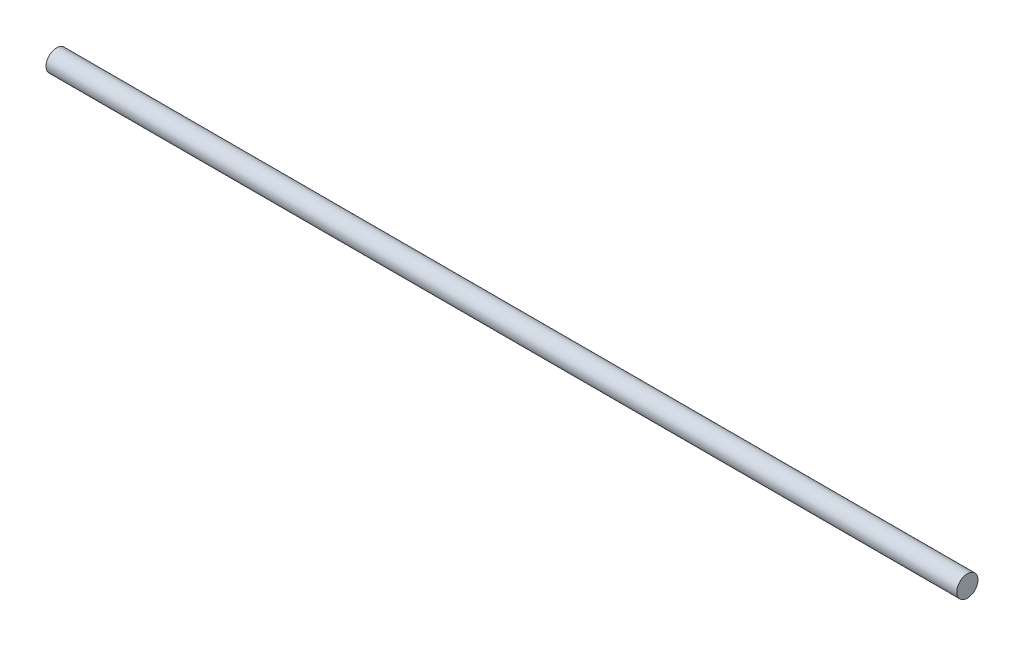
from build123d import *

# Parameters (mm, degrees)
SKETCH_1_R          = 4
EXTRUDE_1_DEPTH     = 191.5
SKETCH_4_R          = 4
CUT_EXTRUDE_2_DEPTH = 40


with BuildPart() as part:
    # 草图1 → 凸台-拉伸1 (new, symmetric)
    with BuildSketch(Plane(origin=(0, 0, 0), x_dir=(0, 0, -1), z_dir=(1, 0, 0))):
        Circle(SKETCH_1_R)
    extrude(amount=EXTRUDE_1_DEPTH, both=True)

    # 草图4 → 切除-拉伸2 (cut)
    with BuildSketch(Plane(origin=(191.5, 0, 0), x_dir=(0, 0, -1), z_dir=(1, 0, 0))):
        Circle(SKETCH_4_R)
    extrude(amount=-CUT_EXTRUDE_2_DEPTH, mode=Mode.SUBTRACT)


solid = part.part
